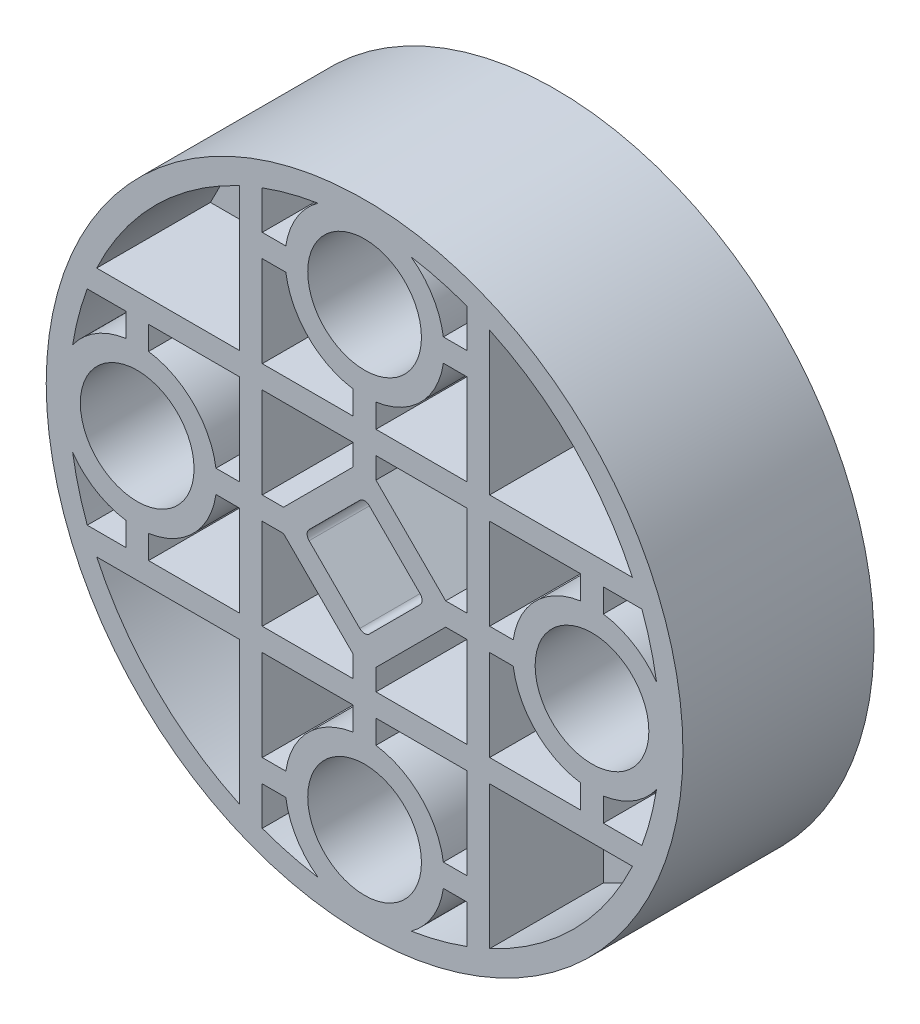
from build123d import *
from build123d.topology import SkipClean

# Parameters (mm, degrees)
SKETCH1_R           = 14
SKETCH1_R_2         = 2.5
BOSS_EXTRUDE1_DEPTH = 9.2
CUT_EXTRUDE1_DEPTH  = 35.709580012
CUT_EXTRUDE2_DEPTH  = 5
CUT_EXTRUDE3_START  = -0.8
SKETCH4_R           = 13
CUT_EXTRUDE3_DEPTH  = 0.8
SKETCH5_R           = 4.25
CUT_EXTRUDE4_DEPTH  = 0.7
BOSS_EXTRUDE2_START = 0.8
SKETCH6_R           = 5.25
SKETCH6_R_2         = 4.25
BOSS_EXTRUDE2_DEPTH = 0.8
CUT_EXTRUDE5_START  = -2.4
CUT_EXTRUDE5_DEPTH  = 2.4
CHAMFER1_SIZE       = 0.6
CUT_EXTRUDE6_DEPTH  = 5
BOSS_EXTRUDE3_DEPTH = 5
BOSS_EXTRUDE4_DEPTH = 0.2
CUT_EXTRUDE7_DEPTH  = 0.2
BOSS_EXTRUDE6_DEPTH = 5
SKETCH14_R          = 18.403092228
CUT_EXTRUDE8_DEPTH  = 14
SKETCH15_W          = 9
SKETCH15_H          = 9
CUT_EXTRUDE9_DEPTH  = 2.4
CUT_EXTRUDE10_DEPTH = 35.506158068
BOSS_EXTRUDE7_START = -5.8
BOSS_EXTRUDE7_DEPTH = 5.8
BOSS_EXTRUDE8_DEPTH = 2.4
FILLET2_R           = 0.3


with BuildPart() as part:
    # Sketch1 → Boss-Extrude1 (new body)
    with BuildSketch(Plane.XY):
        with Locations((-8.02441701, -11.2)):
            Circle(SKETCH1_R)
        with Locations((-18.02441701, -11.2)):
            Circle(SKETCH1_R_2, mode=Mode.SUBTRACT)
        with Locations((-8.02441701, -1.2)):
            Circle(SKETCH1_R_2, mode=Mode.SUBTRACT)
        with Locations((-8.02441701, -21.2)):
            Circle(SKETCH1_R_2, mode=Mode.SUBTRACT)
        with Locations((1.97558299, -11.2)):
            Circle(SKETCH1_R_2, mode=Mode.SUBTRACT)
    extrude(amount=BOSS_EXTRUDE1_DEPTH)

    # Sketch2 → Cut-Extrude1 (cut, through all)
    with BuildSketch(Plane.XY.offset(9.2)):
        with BuildLine():
            Line((-9.97441701, -9.480261648), (-9.97441701, -12.919738352))
            ThreePointArc((-9.97441701, -12.919738352), (-8.02441701, -13.8), (-6.07441701, -12.919738352))
            Line((-6.07441701, -12.919738352), (-6.07441701, -9.480261648))
            ThreePointArc((-6.07441701, -9.480261648), (-8.02441701, -8.6), (-9.97441701, -9.480261648))
        make_face()
    extrude(amount=-CUT_EXTRUDE1_DEPTH, mode=Mode.SUBTRACT)

    # Sketch3 → Cut-Extrude2 (cut)
    with BuildSketch(Plane.XY.offset(9.2)):
        with BuildLine():
            Line((-19.803635999, -5.7), (-13.52441701, -5.7))
            Line((-13.52441701, -5.7), (-13.52441701, 0.579218989))
            ThreePointArc((-13.52441701, 0.579218989), (-17.216805165, -2.007611845), (-19.803635999, -5.7))
        make_face()
        with BuildLine():
            Line((-12.52441701, 0.996310918), (-12.52441701, -5.7))
            Line((-12.52441701, -5.7), (-3.52441701, -5.7))
            Line((-3.52441701, -5.7), (-3.52441701, 0.996310918))
            ThreePointArc((-3.52441701, 0.996310918), (-4.734236904, 1.376752954), (-5.975369975, 1.6375))
            ThreePointArc((-5.975369975, 1.6375), (-4.908196172, 0.393476605), (-4.52441701, -1.2))
            ThreePointArc((-4.52441701, -1.2), (-9.617893614, -4.316220838), (-10.073464044, 1.6375))
            ThreePointArc((-10.073464044, 1.6375), (-11.314597115, 1.376752954), (-12.52441701, 0.996310918))
        make_face()
        with BuildLine():
            Line((-20.220727927, -15.7), (-13.52441701, -15.7))
            Line((-13.52441701, -15.7), (-13.52441701, -6.7))
            Line((-13.52441701, -6.7), (-20.02441701, -6.7))
            Line((-20.02441701, -6.7), (-20.220727927, -6.7))
            ThreePointArc((-20.220727927, -6.7), (-20.601169964, -7.909819895), (-20.86191701, -9.150952965))
            ThreePointArc((-20.86191701, -9.150952965), (-16.947674236, -7.869741001), (-14.52441701, -11.2))
            ThreePointArc((-14.52441701, -11.2), (-16.947674236, -14.530258999), (-20.86191701, -13.249047035))
            ThreePointArc((-20.86191701, -13.249047035), (-20.601169964, -14.490180105), (-20.220727927, -15.7))
        make_face()
        with BuildLine():
            Line((-12.52441701, -6.7), (-12.52441701, -15.7))
            Line((-12.52441701, -15.7), (-8.978356211, -15.7))
            ThreePointArc((-8.978356211, -15.7), (-10.700197469, -14.94168397), (-11.97441701, -13.557435047))
            Line((-11.97441701, -13.557435047), (-11.97441701, -8.842564953))
            ThreePointArc((-11.97441701, -8.842564953), (-10.700197469, -7.45831603), (-8.978356211, -6.7))
            Line((-8.978356211, -6.7), (-12.52441701, -6.7))
        make_face()
        with BuildLine():
            Line((-7.070477808, -15.7), (-3.52441701, -15.7))
            Line((-3.52441701, -15.7), (-3.52441701, -6.7))
            Line((-3.52441701, -6.7), (-7.070477808, -6.7))
            ThreePointArc((-7.070477808, -6.7), (-5.34863655, -7.45831603), (-4.07441701, -8.842564953))
            Line((-4.07441701, -8.842564953), (-4.07441701, -13.557435047))
            ThreePointArc((-4.07441701, -13.557435047), (-5.34863655, -14.94168397), (-7.070477808, -15.7))
        make_face()
        with BuildLine():
            Line((-2.52441701, -6.7), (-2.52441701, -15.7))
            Line((-2.52441701, -15.7), (4.171893908, -15.7))
            ThreePointArc((4.171893908, -15.7), (4.552335945, -14.490180105), (4.81308299, -13.249047035))
            ThreePointArc((4.81308299, -13.249047035), (-1.52441701, -11.2), (4.81308299, -9.150952965))
            ThreePointArc((4.81308299, -9.150952965), (4.552335945, -7.909819895), (4.171893908, -6.7))
            Line((4.171893908, -6.7), (-2.52441701, -6.7))
        make_face()
        with BuildLine():
            Line((-2.52441701, 0.579218989), (-2.52441701, -5.7))
            Line((-2.52441701, -5.7), (3.75480198, -5.7))
            ThreePointArc((3.75480198, -5.7), (1.167971146, -2.007611845), (-2.52441701, 0.579218989))
        make_face()
        with BuildLine():
            Line((3.75480198, -16.7), (-2.52441701, -16.7))
            Line((-2.52441701, -16.7), (-2.52441701, -22.979218989))
            ThreePointArc((-2.52441701, -22.979218989), (1.167971146, -20.392388155), (3.75480198, -16.7))
        make_face()
        with BuildLine():
            Line((-12.52441701, -16.7), (-12.52441701, -23.2))
            Line((-12.52441701, -23.2), (-12.52441701, -23.396310918))
            ThreePointArc((-12.52441701, -23.396310918), (-11.314597115, -23.776752954), (-10.073464044, -24.0375))
            ThreePointArc((-10.073464044, -24.0375), (-9.617893614, -18.083779162), (-4.52441701, -21.2))
            ThreePointArc((-4.52441701, -21.2), (-4.908196172, -22.793476605), (-5.975369975, -24.0375))
            ThreePointArc((-5.975369975, -24.0375), (-4.734236904, -23.776752954), (-3.52441701, -23.396310918))
            Line((-3.52441701, -23.396310918), (-3.52441701, -16.7))
            Line((-3.52441701, -16.7), (-12.52441701, -16.7))
        make_face()
        with BuildLine():
            ThreePointArc((-19.803635999, -16.7), (-17.216805165, -20.392388155), (-13.52441701, -22.979218989))
            Line((-13.52441701, -22.979218989), (-13.52441701, -16.7))
            Line((-13.52441701, -16.7), (-19.803635999, -16.7))
        make_face()
    extrude(amount=-CUT_EXTRUDE2_DEPTH, mode=Mode.SUBTRACT)

    # Sketch4 → Cut-Extrude3 (cut)
    with BuildSketch(Plane(origin=(0, 0, 0), x_dir=(-1, 0, 0), z_dir=(0, 0, -1)).offset(CUT_EXTRUDE3_START)):
        with Locations((8.02441701, -11.2)):
            Circle(SKETCH4_R)
    extrude(amount=CUT_EXTRUDE3_DEPTH, mode=Mode.SUBTRACT)

    # Sketch5 → Cut-Extrude4 (cut)
    with BuildSketch(Plane(origin=(0, 0, 0.8), x_dir=(-1, 0, 0), z_dir=(0, 0, -1))):
        with Locations((8.02441701, -11.2)):
            Circle(SKETCH5_R)
    extrude(amount=-CUT_EXTRUDE4_DEPTH, mode=Mode.SUBTRACT)

    # Sketch6 → Boss-Extrude2 (add)
    with BuildSketch(Plane(origin=(0, 0, 0.8), x_dir=(-1, 0, 0), z_dir=(0, 0, -1)).offset(BOSS_EXTRUDE2_START)):
        with Locations(Location((8.02441701, -11.2, 0), (0, 0, 180))):
            Circle(SKETCH6_R)
        with Locations(Location((8.02441701, -11.2, 0), (0, 0, 180))):
            Circle(SKETCH6_R_2, mode=Mode.SUBTRACT)
    extrude(amount=-BOSS_EXTRUDE2_DEPTH)

    # Sketch7 → Cut-Extrude5 (cut)
    with SkipClean():  # the faces are left unmerged after this step: merging them gives an invalid solid
        with BuildSketch(Plane(origin=(0, 0, 0.8), x_dir=(-1, 0, 0), z_dir=(0, 0, -1)).offset(CUT_EXTRUDE5_START)):
            with BuildLine():
                Line((2.52441701, -5.7), (2.52441701, 0.579218989))
                ThreePointArc((2.52441701, 0.579218989), (-1.167971146, -2.007611845), (-3.75480198, -5.7))
                Line((-3.75480198, -5.7), (2.52441701, -5.7))
            make_face()
            with BuildLine():
                Line((2.52441701, -6.7), (-4.171893908, -6.7))
                ThreePointArc((-4.171893908, -6.7), (-4.552335945, -7.909819895), (-4.81308299, -9.150952965))
                ThreePointArc((-4.81308299, -9.150952965), (-0.898840217, -7.869741001), (1.52441701, -11.2))
                ThreePointArc((1.52441701, -11.2), (-0.898840217, -14.530258999), (-4.81308299, -13.249047035))
                ThreePointArc((-4.81308299, -13.249047035), (-4.552335945, -14.490180105), (-4.171893908, -15.7))
                Line((-4.171893908, -15.7), (2.52441701, -15.7))
                Line((2.52441701, -15.7), (2.52441701, -6.7))
            make_face()
            with BuildLine():
                Line((2.52441701, -16.7), (-3.75480198, -16.7))
                ThreePointArc((-3.75480198, -16.7), (-1.167971146, -20.392388155), (2.52441701, -22.979218989))
                Line((2.52441701, -22.979218989), (2.52441701, -16.7))
            make_face()
            with BuildLine():
                Line((3.52441701, -16.7), (3.52441701, -23.396310918))
                ThreePointArc((3.52441701, -23.396310918), (4.734236904, -23.776752954), (5.975369975, -24.0375))
                ThreePointArc((5.975369975, -24.0375), (6.430940405, -18.083779162), (11.52441701, -21.2))
                ThreePointArc((11.52441701, -21.2), (11.140637848, -22.793476605), (10.073464044, -24.0375))
                ThreePointArc((10.073464044, -24.0375), (11.314597115, -23.776752954), (12.52441701, -23.396310918))
                Line((12.52441701, -23.396310918), (12.52441701, -16.7))
                Line((12.52441701, -16.7), (3.52441701, -16.7))
            make_face()
            with BuildLine():
                Line((3.52441701, 0.996310918), (3.52441701, -5.7))
                Line((3.52441701, -5.7), (12.52441701, -5.7))
                Line((12.52441701, -5.7), (12.52441701, 0.996310918))
                ThreePointArc((12.52441701, 0.996310918), (11.314597115, 1.376752954), (10.073464044, 1.6375))
                ThreePointArc((10.073464044, 1.6375), (11.140637848, 0.393476605), (11.52441701, -1.2))
                ThreePointArc((11.52441701, -1.2), (6.430940405, -4.316220838), (5.975369975, 1.6375))
                ThreePointArc((5.975369975, 1.6375), (4.734236904, 1.376752954), (3.52441701, 0.996310918))
            make_face()
            with BuildLine():
                ThreePointArc((19.803635999, -5.7), (17.216805165, -2.007611845), (13.52441701, 0.579218989))
                Line((13.52441701, 0.579218989), (13.52441701, -5.7))
                Line((13.52441701, -5.7), (19.803635999, -5.7))
            make_face()
            with BuildLine():
                ThreePointArc((20.86191701, -9.150952965), (20.601169964, -7.909819895), (20.220727927, -6.7))
                Line((20.220727927, -6.7), (13.52441701, -6.7))
                Line((13.52441701, -6.7), (13.52441701, -15.7))
                Line((13.52441701, -15.7), (20.220727927, -15.7))
                ThreePointArc((20.220727927, -15.7), (20.601169964, -14.490180105), (20.86191701, -13.249047035))
                ThreePointArc((20.86191701, -13.249047035), (14.52441701, -11.2), (20.86191701, -9.150952965))
            make_face()
            with BuildLine():
                ThreePointArc((13.52441701, -22.979218989), (17.216805165, -20.392388155), (19.803635999, -16.7))
                Line((19.803635999, -16.7), (13.52441701, -16.7))
                Line((13.52441701, -16.7), (13.52441701, -22.979218989))
            make_face()
            with BuildLine():
                Line((10.728580466, -15.7), (12.52441701, -15.7))
                Line((12.52441701, -15.7), (12.52441701, -13.904163457))
                ThreePointArc((12.52441701, -13.904163457), (11.736727611, -14.912310601), (10.728580466, -15.7))
            make_face()
            with BuildLine():
                ThreePointArc((10.728580466, -6.7), (11.736727611, -7.487689399), (12.52441701, -8.495836543))
                Line((12.52441701, -8.495836543), (12.52441701, -6.7))
                Line((12.52441701, -6.7), (10.728580466, -6.7))
            make_face()
            with BuildLine():
                Line((3.52441701, -6.7), (3.52441701, -8.495836543))
                ThreePointArc((3.52441701, -8.495836543), (4.312106408, -7.487689399), (5.320253553, -6.7))
                Line((5.320253553, -6.7), (3.52441701, -6.7))
            make_face()
            with BuildLine():
                Line((3.52441701, -15.7), (5.320253553, -15.7))
                ThreePointArc((5.320253553, -15.7), (4.312106408, -14.912310601), (3.52441701, -13.904163457))
                Line((3.52441701, -13.904163457), (3.52441701, -15.7))
            make_face()
        extrude(amount=CUT_EXTRUDE5_DEPTH, mode=Mode.SUBTRACT)

    # Chamfer1
    chamfer1_edges = [part.edges().sort_by_distance(p)[0] for p in [
        (-8.02441701, -8.6, 1.5),
        (-6.07441701, -11.2, 1.5),
        (-8.02441701, -13.8, 1.5),
        (-9.97441701, -11.2, 1.5),
    ]]
    chamfer(chamfer1_edges, length=CHAMFER1_SIZE)

    # Sketch8 → Cut-Extrude6 (cut)
    with BuildSketch(Plane.XY.offset(9.2)):
        with BuildLine():
            ThreePointArc((-8.978356211, -6.7), (-10.700197469, -7.45831603), (-11.97441701, -8.842564953))
            Line((-11.97441701, -8.842564953), (-11.97441701, -11.084136008))
            Line((-11.97441701, -11.084136008), (-8.02441701, -7.134136008))
            Line((-8.02441701, -7.134136008), (-4.07441701, -11.084136008))
            Line((-4.07441701, -11.084136008), (-4.07441701, -8.842564953))
            ThreePointArc((-4.07441701, -8.842564953), (-5.34863655, -7.45831603), (-7.070477808, -6.7))
            Line((-7.070477808, -6.7), (-8.978356211, -6.7))
        make_face()
        with BuildLine():
            Line((-8.02441701, -15.265863992), (-11.97441701, -11.315863992))
            Line((-11.97441701, -11.315863992), (-11.97441701, -13.557435047))
            ThreePointArc((-11.97441701, -13.557435047), (-10.700197469, -14.94168397), (-8.978356211, -15.7))
            Line((-8.978356211, -15.7), (-7.070477808, -15.7))
            ThreePointArc((-7.070477808, -15.7), (-5.34863655, -14.94168397), (-4.07441701, -13.557435047))
            Line((-4.07441701, -13.557435047), (-4.07441701, -11.315863992))
            Line((-4.07441701, -11.315863992), (-8.02441701, -15.265863992))
        make_face()
    extrude(amount=-CUT_EXTRUDE6_DEPTH, mode=Mode.SUBTRACT)

    # Sketch9 → Boss-Extrude3 (add)
    with BuildSketch(Plane.XY.offset(9.2)):
        Polygon((-12.090281001, -11.2), (-11.97441701, -11.315863992), (-11.97441701, -11.084136008), align=None)
        Polygon((-4.07441701, -11.084136008), (-4.07441701, -11.315863992), (-3.958553018, -11.2), align=None)
    extrude(amount=-BOSS_EXTRUDE3_DEPTH)

    # Sketch10 → Boss-Extrude4 (add)
    with SkipClean():  # the faces are left unmerged after this step: merging them gives an invalid solid
        with BuildSketch(Plane.XY.offset(9.2)):
            Polygon((-8.02441701, -7.134136008), (-12.090281001, -11.2), (-8.02441701, -15.265863992), (-3.958553018, -11.2), align=None)
        extrude(amount=-BOSS_EXTRUDE4_DEPTH)

    # Sketch11 → Cut-Extrude7 (cut)
    with BuildSketch(Plane.XY.offset(9.2)):
        Polygon((-8.02441701, -8.548349571), (-10.676067439, -11.2), (-8.02441701, -13.851650429), (-5.37276658, -11.2), align=None)
    extrude(amount=-CUT_EXTRUDE7_DEPTH, mode=Mode.SUBTRACT)

    # Sketch13 → Boss-Extrude6 (add)
    with BuildSketch(Plane.XY.offset(9.2)):
        with BuildLine():
            ThreePointArc((-11.488518625, -21.7), (-11.52441701, -21.2), (-11.488518625, -20.7))
            Line((-11.488518625, -20.7), (-12.52441701, -20.7))
            Line((-12.52441701, -20.7), (-12.52441701, -21.7))
            Line((-12.52441701, -21.7), (-11.488518625, -21.7))
        make_face()
        with BuildLine():
            Line((-7.52441701, -16.7), (-8.52441701, -16.7))
            Line((-8.52441701, -16.7), (-8.52441701, -17.735898385))
            ThreePointArc((-8.52441701, -17.735898385), (-8.02441701, -17.7), (-7.52441701, -17.735898385))
            Line((-7.52441701, -17.735898385), (-7.52441701, -16.7))
        make_face()
        with BuildLine():
            Line((-3.52441701, -20.7), (-4.560315394, -20.7))
            ThreePointArc((-4.560315394, -20.7), (-4.52441701, -21.2), (-4.560315394, -21.7))
            Line((-4.560315394, -21.7), (-3.52441701, -21.7))
            Line((-3.52441701, -21.7), (-3.52441701, -20.7))
        make_face()
        with BuildLine():
            Line((1.47558299, -14.664101615), (1.47558299, -15.7))
            Line((1.47558299, -15.7), (2.47558299, -15.7))
            Line((2.47558299, -15.7), (2.47558299, -14.664101615))
            ThreePointArc((2.47558299, -14.664101615), (1.97558299, -14.7), (1.47558299, -14.664101615))
        make_face()
        with BuildLine():
            Line((-2.52441701, -10.7), (-2.52441701, -11.7))
            Line((-2.52441701, -11.7), (-1.488518625, -11.7))
            ThreePointArc((-1.488518625, -11.7), (-1.52441701, -11.2), (-1.488518625, -10.7))
            Line((-1.488518625, -10.7), (-2.52441701, -10.7))
        make_face()
        with BuildLine():
            Line((2.47558299, -6.7), (1.47558299, -6.7))
            Line((1.47558299, -6.7), (1.47558299, -7.735898385))
            ThreePointArc((1.47558299, -7.735898385), (1.97558299, -7.7), (2.47558299, -7.735898385))
            Line((2.47558299, -7.735898385), (2.47558299, -6.7))
        make_face()
        with BuildLine():
            Line((-4.560315394, -1.7), (-3.52441701, -1.7))
            Line((-3.52441701, -1.7), (-3.52441701, -0.7))
            Line((-3.52441701, -0.7), (-4.560315394, -0.7))
            ThreePointArc((-4.560315394, -0.7), (-4.52441701, -1.2), (-4.560315394, -1.7))
        make_face()
        with BuildLine():
            Line((-8.52441701, -4.664101615), (-8.52441701, -5.7))
            Line((-8.52441701, -5.7), (-7.52441701, -5.7))
            Line((-7.52441701, -5.7), (-7.52441701, -4.664101615))
            ThreePointArc((-7.52441701, -4.664101615), (-8.02441701, -4.7), (-8.52441701, -4.664101615))
        make_face()
        with BuildLine():
            Line((-12.52441701, -0.7), (-12.52441701, -1.7))
            Line((-12.52441701, -1.7), (-11.488518625, -1.7))
            ThreePointArc((-11.488518625, -1.7), (-11.52441701, -1.2), (-11.488518625, -0.7))
            Line((-11.488518625, -0.7), (-12.52441701, -0.7))
        make_face()
        with BuildLine():
            Line((-14.560315394, -11.7), (-13.52441701, -11.7))
            Line((-13.52441701, -11.7), (-13.52441701, -10.7))
            Line((-13.52441701, -10.7), (-14.560315394, -10.7))
            ThreePointArc((-14.560315394, -10.7), (-14.52441701, -11.2), (-14.560315394, -11.7))
        make_face()
        with BuildLine():
            Line((-18.52441701, -6.7), (-18.52441701, -7.735898385))
            ThreePointArc((-18.52441701, -7.735898385), (-18.02441701, -7.7), (-17.52441701, -7.735898385))
            Line((-17.52441701, -7.735898385), (-17.52441701, -6.7))
            Line((-17.52441701, -6.7), (-18.52441701, -6.7))
        make_face()
        with BuildLine():
            Line((-18.52441701, -14.664101615), (-18.52441701, -15.7))
            Line((-18.52441701, -15.7), (-17.52441701, -15.7))
            Line((-17.52441701, -15.7), (-17.52441701, -14.664101615))
            ThreePointArc((-17.52441701, -14.664101615), (-18.02441701, -14.7), (-18.52441701, -14.664101615))
        make_face()
        Polygon((-12.52441701, -10.7), (-12.52441701, -11.7), (-11.590281001, -11.7), (-12.090281001, -11.2), (-11.590281001, -10.7), align=None)
        Polygon((-3.958553018, -11.2), (-4.458553018, -11.7), (-3.52441701, -11.7), (-3.52441701, -10.7), (-4.458553018, -10.7), align=None)
        Polygon((-8.02441701, -15.265863992), (-8.52441701, -14.765863992), (-8.52441701, -15.7), (-7.52441701, -15.7), (-7.52441701, -14.765863992), align=None)
        Polygon((-8.52441701, -6.7), (-8.52441701, -7.634136008), (-8.02441701, -7.134136008), (-7.52441701, -7.634136008), (-7.52441701, -6.7), align=None)
    extrude(amount=-BOSS_EXTRUDE6_DEPTH)

    # Sketch14 → Cut-Extrude8 (cut)
    with BuildSketch(Plane(origin=(0, 0, 0.8), x_dir=(-1, 0, 0), z_dir=(0, 0, -1))):
        with Locations((8.02441701, -11.2)):
            Circle(SKETCH14_R)
    extrude(amount=CUT_EXTRUDE8_DEPTH, mode=Mode.SUBTRACT)

    # Sketch15 → Cut-Extrude9 (cut)
    with BuildSketch(Plane(origin=(0, 0, 0.8), x_dir=(-1, 0, 0), z_dir=(0, 0, -1))):
        with Locations((8.02441701, -11.2)):
            Rectangle(SKETCH15_W, SKETCH15_H)
    extrude(amount=-CUT_EXTRUDE9_DEPTH, mode=Mode.SUBTRACT)

    # Sketch18 → Cut-Extrude10 (cut, through all)
    with BuildSketch(Plane.XY.offset(9.2)):
        Polygon((-8.02441701, -8.548349571), (-10.676067439, -11.2), (-8.02441701, -13.851650429), (-5.37276658, -11.2), align=None)
    extrude(amount=-CUT_EXTRUDE10_DEPTH, mode=Mode.SUBTRACT)

    # Sketch19 → Boss-Extrude7 (add)
    with BuildSketch(Plane(origin=(0, 0, 3.2), x_dir=(-1, 0, 0), z_dir=(0, 0, -1)).offset(BOSS_EXTRUDE7_START)):
        with BuildLine():
            Line((6.07441701, -10.498349571), (7.972243042, -8.600523538))
            ThreePointArc((7.972243042, -8.600523538), (6.930954649, -8.841114656), (6.07441701, -9.480261648))
            Line((6.07441701, -9.480261648), (6.07441701, -10.498349571))
        make_face()
        with BuildLine():
            Line((9.97441701, -10.498349571), (8.076590977, -8.600523538))
            ThreePointArc((8.076590977, -8.600523538), (9.11787937, -8.841114656), (9.97441701, -9.480261648))
            Line((9.97441701, -9.480261648), (9.97441701, -10.498349571))
        make_face()
        with BuildLine():
            Line((7.972243042, -13.799476462), (6.07441701, -11.901650429))
            Line((6.07441701, -11.901650429), (6.07441701, -12.919738352))
            ThreePointArc((6.07441701, -12.919738352), (6.930954649, -13.558885344), (7.972243042, -13.799476462))
        make_face()
        with BuildLine():
            Line((8.076590977, -13.799476462), (9.97441701, -11.901650429))
            Line((9.97441701, -11.901650429), (9.97441701, -12.919738352))
            ThreePointArc((9.97441701, -12.919738352), (9.11787937, -13.558885344), (8.076590977, -13.799476462))
        make_face()
    extrude(amount=BOSS_EXTRUDE7_DEPTH)

    # Sketch20 → Boss-Extrude8 (add)
    with BuildSketch(Plane(origin=(0, 0, 3.2), x_dir=(-1, 0, 0), z_dir=(0, 0, -1))):
        with BuildLine():
            Line((-1.47558299, -7.735898385), (-1.47558299, -6.7))
            Line((-1.47558299, -6.7), (-2.47558299, -6.7))
            Line((-2.47558299, -6.7), (-2.47558299, -7.735898385))
            ThreePointArc((-2.47558299, -7.735898385), (-1.97558299, -7.7), (-1.47558299, -7.735898385))
        make_face()
        with BuildLine():
            Line((-1.47558299, -15.7), (-1.47558299, -14.664101615))
            ThreePointArc((-1.47558299, -14.664101615), (-1.97558299, -14.7), (-2.47558299, -14.664101615))
            Line((-2.47558299, -14.664101615), (-2.47558299, -15.7))
            Line((-2.47558299, -15.7), (-1.47558299, -15.7))
        make_face()
        with BuildLine():
            Line((2.52441701, -11.7), (2.52441701, -10.7))
            Line((2.52441701, -10.7), (1.488518625, -10.7))
            ThreePointArc((1.488518625, -10.7), (1.52441701, -11.2), (1.488518625, -11.7))
            Line((1.488518625, -11.7), (2.52441701, -11.7))
        make_face()
        Polygon((3.958553018, -11.2), (4.458553018, -10.7), (3.52441701, -10.7), (3.52441701, -11.7), (4.458553018, -11.7), align=None)
        Polygon((5.87276658, -10.7), (4.458553018, -10.7), (3.958553018, -11.2), (4.458553018, -11.7), (5.87276658, -11.7), (5.37276658, -11.2), align=None)
        Polygon((4.458553018, -11.7), (7.52441701, -14.765863992), (7.52441701, -13.351650429), (5.87276658, -11.7), align=None)
        Polygon((8.02441701, -15.265863992), (8.52441701, -14.765863992), (8.52441701, -13.351650429), (8.02441701, -13.851650429), (7.52441701, -13.351650429), (7.52441701, -14.765863992), align=None)
        Polygon((8.52441701, -14.765863992), (11.590281001, -11.7), (10.176067439, -11.7), (8.52441701, -13.351650429), align=None)
        Polygon((11.590281001, -11.7), (12.090281001, -11.2), (11.590281001, -10.7), (10.176067439, -10.7), (10.676067439, -11.2), (10.176067439, -11.7), align=None)
        Polygon((10.176067439, -10.7), (11.590281001, -10.7), (8.52441701, -7.634136008), (8.52441701, -9.048349571), align=None)
        Polygon((8.52441701, -9.048349571), (8.52441701, -7.634136008), (8.02441701, -7.134136008), (7.52441701, -7.634136008), (7.52441701, -9.048349571), (8.02441701, -8.548349571), align=None)
        Polygon((7.52441701, -9.048349571), (7.52441701, -7.634136008), (4.458553018, -10.7), (5.87276658, -10.7), align=None)
        Polygon((11.590281001, -10.7), (12.090281001, -11.2), (11.590281001, -11.7), (12.52441701, -11.7), (12.52441701, -10.7), align=None)
        Polygon((8.52441701, -15.7), (8.52441701, -14.765863992), (8.02441701, -15.265863992), (7.52441701, -14.765863992), (7.52441701, -15.7), align=None)
        Polygon((8.02441701, -7.134136008), (8.52441701, -7.634136008), (8.52441701, -6.7), (7.52441701, -6.7), (7.52441701, -7.634136008), align=None)
        with BuildLine():
            Line((7.52441701, -5.7), (8.52441701, -5.7))
            Line((8.52441701, -5.7), (8.52441701, -4.664101615))
            ThreePointArc((8.52441701, -4.664101615), (8.02441701, -4.7), (7.52441701, -4.664101615))
            Line((7.52441701, -4.664101615), (7.52441701, -5.7))
        make_face()
        with BuildLine():
            ThreePointArc((11.488518625, -0.7), (11.52441701, -1.2), (11.488518625, -1.7))
            Line((11.488518625, -1.7), (12.52441701, -1.7))
            Line((12.52441701, -1.7), (12.52441701, -0.7))
            Line((12.52441701, -0.7), (11.488518625, -0.7))
        make_face()
        with BuildLine():
            Line((3.52441701, -1.7), (4.560315394, -1.7))
            ThreePointArc((4.560315394, -1.7), (4.52441701, -1.2), (4.560315394, -0.7))
            Line((4.560315394, -0.7), (3.52441701, -0.7))
            Line((3.52441701, -0.7), (3.52441701, -1.7))
        make_face()
        with BuildLine():
            Line((14.560315394, -10.7), (13.52441701, -10.7))
            Line((13.52441701, -10.7), (13.52441701, -11.7))
            Line((13.52441701, -11.7), (14.560315394, -11.7))
            ThreePointArc((14.560315394, -11.7), (14.52441701, -11.2), (14.560315394, -10.7))
        make_face()
        with BuildLine():
            Line((18.52441701, -6.7), (17.52441701, -6.7))
            Line((17.52441701, -6.7), (17.52441701, -7.735898385))
            ThreePointArc((17.52441701, -7.735898385), (18.02441701, -7.7), (18.52441701, -7.735898385))
            Line((18.52441701, -7.735898385), (18.52441701, -6.7))
        make_face()
        with BuildLine():
            Line((17.52441701, -14.664101615), (17.52441701, -15.7))
            Line((17.52441701, -15.7), (18.52441701, -15.7))
            Line((18.52441701, -15.7), (18.52441701, -14.664101615))
            ThreePointArc((18.52441701, -14.664101615), (18.02441701, -14.7), (17.52441701, -14.664101615))
        make_face()
        with BuildLine():
            Line((8.52441701, -17.735898385), (8.52441701, -16.7))
            Line((8.52441701, -16.7), (7.52441701, -16.7))
            Line((7.52441701, -16.7), (7.52441701, -17.735898385))
            ThreePointArc((7.52441701, -17.735898385), (8.02441701, -17.7), (8.52441701, -17.735898385))
        make_face()
        with BuildLine():
            Line((12.52441701, -20.7), (11.488518625, -20.7))
            ThreePointArc((11.488518625, -20.7), (11.52441701, -21.2), (11.488518625, -21.7))
            Line((11.488518625, -21.7), (12.52441701, -21.7))
            Line((12.52441701, -21.7), (12.52441701, -20.7))
        make_face()
        with BuildLine():
            ThreePointArc((4.560315394, -21.7), (4.52441701, -21.2), (4.560315394, -20.7))
            Line((4.560315394, -20.7), (3.52441701, -20.7))
            Line((3.52441701, -20.7), (3.52441701, -21.7))
            Line((3.52441701, -21.7), (4.560315394, -21.7))
        make_face()
    extrude(amount=BOSS_EXTRUDE8_DEPTH)

    # Fillet2
    fillet2_edges = [part.edges().sort_by_distance(p)[0] for p in [
        (-10.676067439, -11.2, 5),
        (-8.02441701, -8.548349571, 5),
        (-5.37276658, -11.2, 5),
        (-8.02441701, -13.851650429, 5),
    ]]
    fillet(fillet2_edges, radius=FILLET2_R)


solid = part.part
